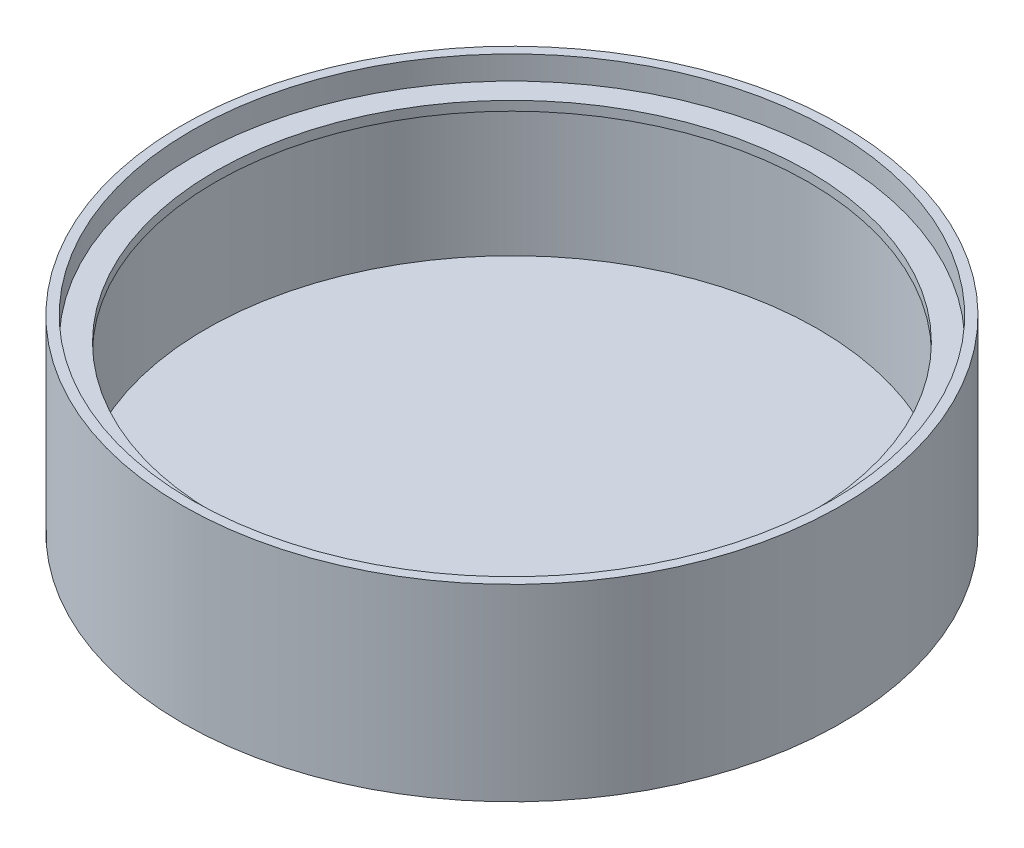
from build123d import *

# Parameters (mm, degrees)
SKETCH2_R           = 70
BOSS_EXTRUDE1_DEPTH = 40
SKETCH4_R           = 63
CUT_EXTRUDE1_DEPTH  = 35
SKETCH5_R           = 68
CUT_EXTRUDE2_DEPTH  = 5
SKETCH6_R           = 65
CUT_EXTRUDE3_DEPTH  = 28


with BuildPart() as part:
    # Sketch2 → Boss-Extrude1 (new body)
    with BuildSketch(Plane(origin=(0, 0, 0), x_dir=(1, 0, 0), z_dir=(0, 1, 0))):
        with Locations(Location((0, 0, 0), (0, 0, 270))):
            Circle(SKETCH2_R)
    extrude(amount=BOSS_EXTRUDE1_DEPTH)

    # Sketch4 → Cut-Extrude1 (cut)
    with BuildSketch(Plane(origin=(0, 40, 0), x_dir=(1, 0, 0), z_dir=(0, 1, 0))):
        with Locations(Location((0, 0, 0), (0, 0, 270))):
            Circle(SKETCH4_R)
    extrude(amount=-CUT_EXTRUDE1_DEPTH, mode=Mode.SUBTRACT)

    # Sketch5 → Cut-Extrude2 (cut)
    with BuildSketch(Plane(origin=(0, 40, 0), x_dir=(1, 0, 0), z_dir=(0, 1, 0))):
        with Locations(Location((0, 0, 0), (0, 0, 270))):
            Circle(SKETCH5_R)
    extrude(amount=-CUT_EXTRUDE2_DEPTH, mode=Mode.SUBTRACT)

    # Sketch6 → Cut-Extrude3 (cut)
    with BuildSketch(Plane(origin=(0, 33, 0), x_dir=(1, 0, 0), z_dir=(0, 1, 0))):
        with Locations(Location((0, 0, 0), (0, 0, 270))):
            Circle(SKETCH6_R)
    extrude(amount=-CUT_EXTRUDE3_DEPTH, mode=Mode.SUBTRACT)


solid = part.part
